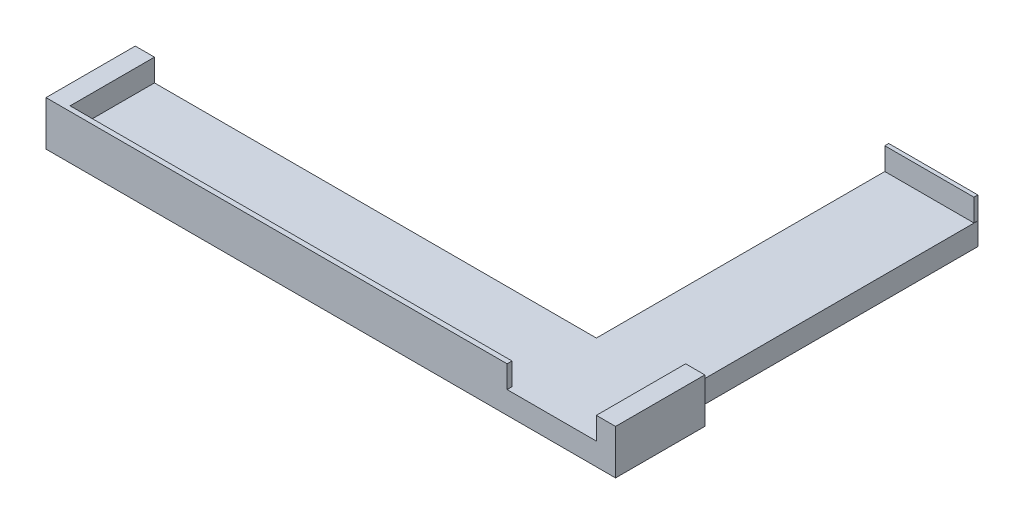
from build123d import *

# Parameters (mm, degrees)
EXTRUDE_6_DEPTH   = 10
SKETCH_1_W        = 4.3
SKETCH_1_H        = 20
EXTRUDE_6_2_DEPTH = 10
SKETCH_1_W_2      = 19.968743504
SKETCH_1_H_2      = 0.87958721
EXTRUDE_6_3_DEPTH = 10
EXTRUDE_7_DEPTH   = 5


with BuildPart() as part:
    # 草图1 → 凸台-拉伸6 (new body)
    with BuildSketch(Plane(origin=(0, 0, 0), x_dir=(1, 0, 0), z_dir=(0, 1, 0))):
        Polygon((-63.8, 10), (-63.8, -10), (39.5, -10), (39.5, -8.900223152), (-59.5, -8.900223152), (-59.5, 10), align=None)
    extrude(amount=EXTRUDE_6_DEPTH)



with BuildPart() as body_2:
    # 草图1 → Extrude 6 2 (new body)
    with BuildSketch(Plane(origin=(0, 0, 0), x_dir=(1, 0, 0), z_dir=(0, 1, 0))):
        with Locations((61.65, 0)):
            Rectangle(SKETCH_1_W, SKETCH_1_H)
    extrude(amount=EXTRUDE_6_2_DEPTH)


with BuildPart() as body_3:
    # 草图1 → Extrude 6 3 (new body)
    with BuildSketch(Plane(origin=(0, 0, 0), x_dir=(1, 0, 0), z_dir=(0, 1, 0))):
        with Locations((49.484371752, 75.060206395)):
            Rectangle(SKETCH_1_W_2, SKETCH_1_H_2)
    extrude(amount=EXTRUDE_6_3_DEPTH)


with BuildPart() as part_1:
    add(part.part)

    add(body_2.part)  # 凸台-拉伸7 merges body 2

    add(body_3.part)  # 凸台-拉伸7 merges body 3
    # 草图1<15> → 凸台-拉伸7 (add)
    with BuildSketch(Plane(origin=(0, 0, 0), x_dir=(1, 0, 0), z_dir=(0, 1, 0))):
        Polygon((39.5, -8.900223152), (39.5, -10), (59.5, -10), (59.5, 75.5), (59.468743504, 75.5), (59.468743504, 74.62041279), (39.5, 74.62041279), (39.5, 10), (-59.5, 10), (-59.5, -8.900223152), align=None)
    extrude(amount=EXTRUDE_7_DEPTH)


solid = part_1.part
